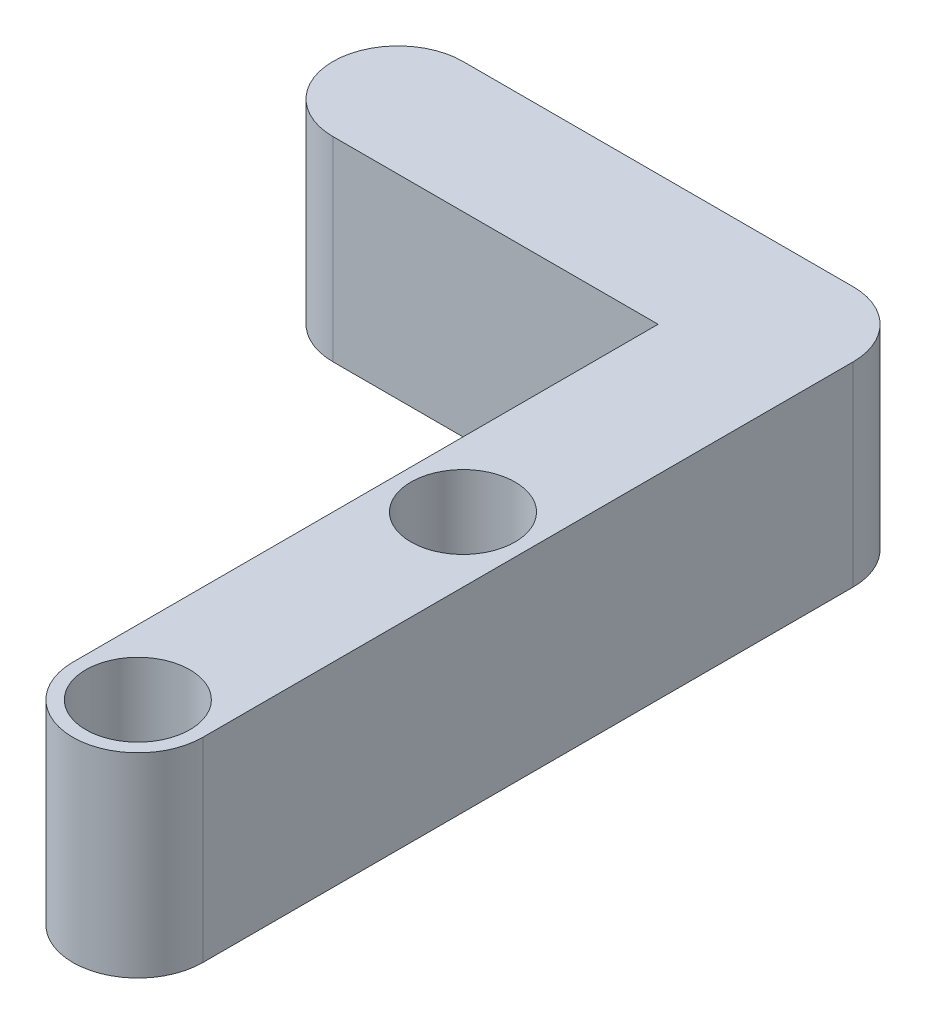
from build123d import *

# Parameters (mm, degrees)
SKETCH1_R           = 0.4
BOSS_EXTRUDE1_DEPTH = 1.5


with BuildPart() as part:
    # Sketch1 → Boss-Extrude1 (new body)
    with BuildSketch(Plane(origin=(0, 0, 0), x_dir=(1, 0, 0), z_dir=(0, 1, 0))):
        with BuildLine():
            Line((-38.122946219, -19.363563947), (-38.122946219, -14.363563947))
            ThreePointArc((-38.122946219, -14.363563947), (-38.269392829, -14.010010556), (-38.622946219, -13.863563947))
            Line((-38.622946219, -13.863563947), (-41.622946219, -13.863563947))
            ThreePointArc((-41.622946219, -13.863563947), (-42.122946219, -14.363563947), (-41.622946219, -14.863563947))
            Line((-41.622946219, -14.863563947), (-39.122946219, -14.863563947))
            Line((-39.122946219, -14.863563947), (-39.122946219, -19.363563947))
            ThreePointArc((-39.122946219, -19.363563947), (-38.622946219, -19.863563947), (-38.122946219, -19.363563947))
        make_face()
        with Locations(Location((-38.622946219, -19.363563947, 0), (0, 0, 270))):
            Circle(SKETCH1_R, mode=Mode.SUBTRACT)
        with BuildLine():
            ThreePointArc((-38.622946219, -17.263563947), (-39.022946219, -16.863563947), (-38.622946219, -16.463563947))
            ThreePointArc((-38.622946219, -16.463563947), (-38.222946219, -16.863563947), (-38.622946219, -17.263563947))
        make_face(mode=Mode.SUBTRACT)
    extrude(amount=BOSS_EXTRUDE1_DEPTH)


solid = part.part
